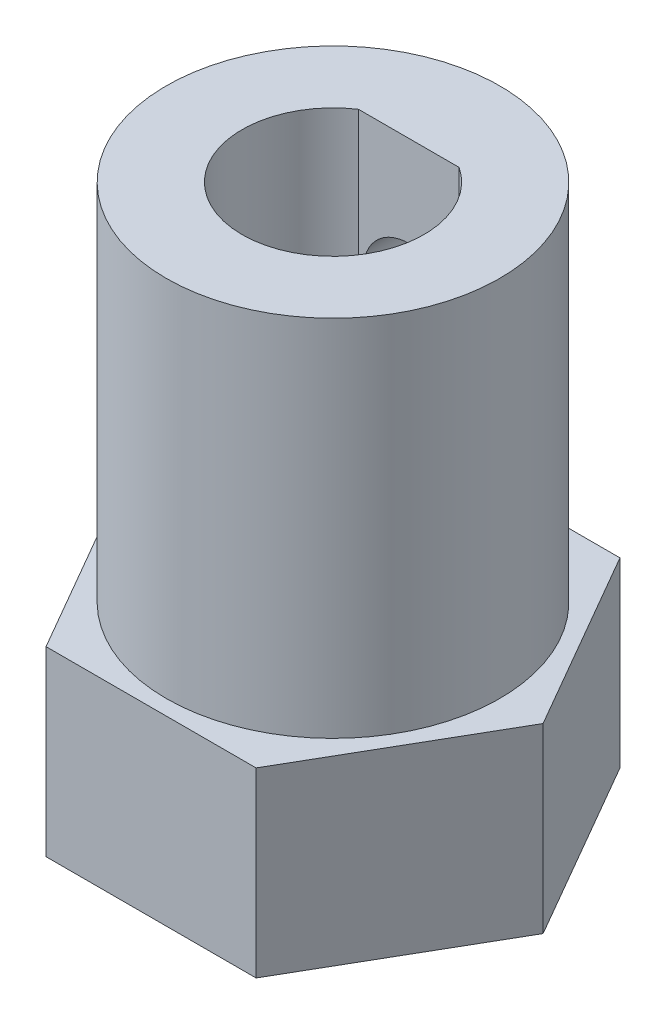
from build123d import *

# Parameters (mm, degrees)
SALIENTE_EXTRUIR1_DEPTH = 6
CROQUIS_BODY_R          = 5.5
SALIENTE_EXTRUIR2_DEPTH = 12
CORTAR_EXTRUIR1_DEPTH   = 12
CROQUIS5_R              = 1.5
CORTAR_EXTRUIR2_DEPTH   = 3.5
CROQUIS6_R              = 2
CORTAR_EXTRUIR3_DEPTH   = 6


with BuildPart() as part:
    # Croquis hex-head → Saliente-Extruir1 (new body)
    with BuildSketch(Plane(origin=(0, 0, 0), x_dir=(1, 0, 0), z_dir=(0, 1, 0))):
        Polygon((6.92820323, 0), (3.464101615, 6), (-3.464101615, 6), (-6.92820323, 0), (-3.464101615, -6), (3.464101615, -6), align=None)
    extrude(amount=SALIENTE_EXTRUIR1_DEPTH)

    # Croquis body → Saliente-Extruir2 (add)
    with BuildSketch(Plane(origin=(0, 6, 0), x_dir=(1, 0, 0), z_dir=(0, 1, 0))):
        with Locations(Location((0, 0, 0), (0, 0, 270))):
            Circle(CROQUIS_BODY_R)
    extrude(amount=SALIENTE_EXTRUIR2_DEPTH)

    # Croquis inner → Cortar-Extruir1 (cut)
    with BuildSketch(Plane(origin=(0, 18, 0), x_dir=(1, 0, 0), z_dir=(0, 1, 0))):
        with BuildLine():
            Line((-1.658312395, 2.5), (1.658312395, 2.5))
            ThreePointArc((1.658312395, 2.5), (0, -3), (-1.658312395, 2.5))
        make_face()
    extrude(amount=-CORTAR_EXTRUIR1_DEPTH, mode=Mode.SUBTRACT)

    # Croquis5 → Cortar-Extruir2 (cut)
    with BuildSketch(Plane(origin=(0, 0, -6), x_dir=(-1, 0, 0), z_dir=(0, 0, -1))):
        with Locations((0, 13.5)):
            Circle(CROQUIS5_R)
    extrude(amount=-CORTAR_EXTRUIR2_DEPTH, mode=Mode.SUBTRACT)

    # Croquis6 → Cortar-Extruir3 (cut)
    with BuildSketch(Plane.XZ):
        with Locations(Location((0, 0, 0), (0, 0, 270))):
            Circle(CROQUIS6_R)
    extrude(amount=-CORTAR_EXTRUIR3_DEPTH, mode=Mode.SUBTRACT)


solid = part.part
